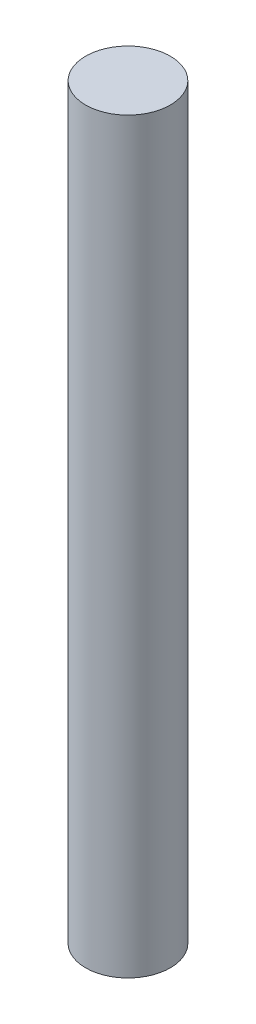
from build123d import *

# Parameters (mm, degrees)
SKETCH1_R           = 1.7
BOSS_EXTRUDE1_DEPTH = 30


with BuildPart() as part:
    # Sketch1 → Boss-Extrude1 (new body)
    with BuildSketch(Plane(origin=(0, 0, 0), x_dir=(1, 0, 0), z_dir=(0, 1, 0))):
        with Locations(Location((-1.624780785, 18.073430143, 0), (0, 0, 270))):
            Circle(SKETCH1_R)
    extrude(amount=BOSS_EXTRUDE1_DEPTH)


solid = part.part
